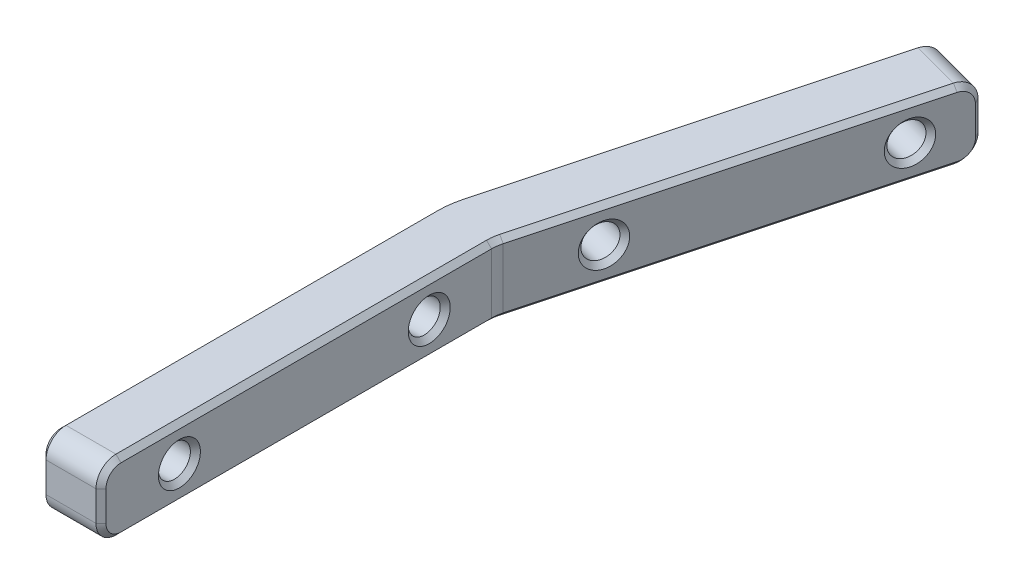
from build123d import *

# Parameters (mm, degrees)
BOSS_EXTRUDE1_DEPTH = 8.89
SKETCH2_R           = 2.032
CUT_EXTRUDE1_DEPTH  = 54.189709887
CUT_EXTRUDE2_REACH  = 55.452
SKETCH3_R           = 2.032
FILLET1_R           = 2.54
FILLET2_R           = 5.08
FILLET3_R           = 11.43
CHAMFER1_SIZE       = 0.635


with BuildPart() as part:
    # Sketch1 → Boss-Extrude1 (new body)
    with BuildSketch(Plane(origin=(0, 0, 0), x_dir=(1, 0, 0), z_dir=(0, 1, 0))):
        Polygon((3.81, -0.501596016), (3.81, -50.8), (-3.81, -50.8), (-3.81, 0.501596016), (9.467830093, 50.055132537), (16.828184889, 48.082931414), align=None)
    extrude(amount=BOSS_EXTRUDE1_DEPTH)

    # Sketch2 → Cut-Extrude1 (cut, through all)
    with BuildSketch(Plane(origin=(3.81, 0, 0), x_dir=(0, 0, -1), z_dir=(1, 0, 0))):
        with Locations((-40.833442343, 4.445)):
            Circle(SKETCH2_R)
        with Locations((-9.083442343, 4.445)):
            Circle(SKETCH2_R)
    extrude(amount=-CUT_EXTRUDE1_DEPTH, mode=Mode.SUBTRACT)

    # Sketch3 → Cut-Extrude2 (cut, up to next)
    with BuildSketch(Plane(origin=(3.680177398, 0, 0.986100562), x_dir=(0.25881904510251424, 0, -0.9659258262890701), z_dir=(0.9659258262890701, 0, 0.25881904510251424)), mode=Mode.PRIVATE) as cut_extrude2_sk1:
        with Locations((43.373442343, 4.445)):
            Circle(SKETCH3_R)
    cut_extrude2_tool1 = extrude(cut_extrude2_sk1.sketch, amount=-CUT_EXTRUDE2_REACH, mode=Mode.PRIVATE) & part.part
    # Sketch3 → Cut-Extrude2 (cut, up to next)
    with BuildSketch(Plane(origin=(3.680177398, 0, 0.986100562), x_dir=(0.25881904510251424, 0, -0.9659258262890701), z_dir=(0.9659258262890701, 0, 0.25881904510251424)), mode=Mode.PRIVATE) as cut_extrude2_sk2:
        with Locations((11.623442343, 4.445)):
            Circle(SKETCH3_R)
    cut_extrude2_tool2 = extrude(cut_extrude2_sk2.sketch, amount=-CUT_EXTRUDE2_REACH, mode=Mode.PRIVATE) & part.part
    add(cut_extrude2_tool1.solids().sort_by_distance((14.90605, 4.445, -40.909428))[0], mode=Mode.SUBTRACT)
    add(cut_extrude2_tool2.solids().sort_by_distance((6.688546, 4.445, -10.241283))[0], mode=Mode.SUBTRACT)

    # Fillet1
    fillet1_edges = [part.edges().sort_by_distance(p)[0] for p in [
        (13.148007491, 8.89, -49.069031975),
        (13.148007491, 0, -49.069031975),
        (0, 0, 50.8),
        (0, 8.89, 50.8),
    ]]
    fillet(fillet1_edges, radius=FILLET1_R)

    # Fillet2
    fillet2_edges = [part.edges().sort_by_distance(p)[0] for p in [
        (3.81, 4.445, 0.501596016),
    ]]
    fillet(fillet2_edges, radius=FILLET2_R)

    # Fillet3
    fillet3_edges = [part.edges().sort_by_distance(p)[0] for p in [
        (-3.81, 4.445, -0.501596016),
    ]]
    fillet(fillet3_edges, radius=FILLET3_R)

    # Chamfer1
    chamfer1_edges = [part.edges().sort_by_distance(p)[0] for p in [
        (-3.81, 4.445, 11.115442343),
        (3.81, 4.445, 11.115442343),
        (-3.81, 4.445, 42.865442343),
        (3.81, 4.445, 42.865442343),
        (-1.19772945, 4.445, -10.250722432),
        (6.162625347, 4.445, -8.278521309),
        (7.019775232, 4.445, -40.918867417),
        (14.380130029, 4.445, -38.946666293),
        (9.467830093, 4.445, -50.055132537),
        (16.828184889, 4.445, -48.082931414),
        (9.275281981, 8.146051224, -49.336533201),
        (9.275281981, 0.743948776, -49.336533201),
        (16.635636778, 8.146051224, -47.364332078),
        (16.635636778, 0.743948776, -47.364332078),
        (-3.81, 4.445, 50.8),
        (-3.81, 8.146051224, 50.056051224),
        (-3.81, 0.743948776, 50.056051224),
        (3.81, 4.445, 50.8),
        (3.81, 8.146051224, 50.056051224),
        (3.81, 0.743948776, 50.056051224),
        (10.076940659, 0, -22.88694493),
        (10.076940659, 8.89, -22.88694493),
        (3.81, 0, 24.715195352),
        (3.81, 8.89, 24.715195352),
        (3.853460104, 0, 0.507317647),
        (3.853460104, 8.89, 0.507317647),
        (-3.81, 0, 24.631596016),
        (-3.81, 8.89, 24.631596016),
        (2.694948762, 0, -24.778395296),
        (-3.712214766, 0, -0.488722345),
        (2.694948762, 8.89, -24.778395296),
        (-3.712214766, 8.89, -0.488722345),
    ]]
    chamfer(chamfer1_edges, length=CHAMFER1_SIZE)


solid = part.part
